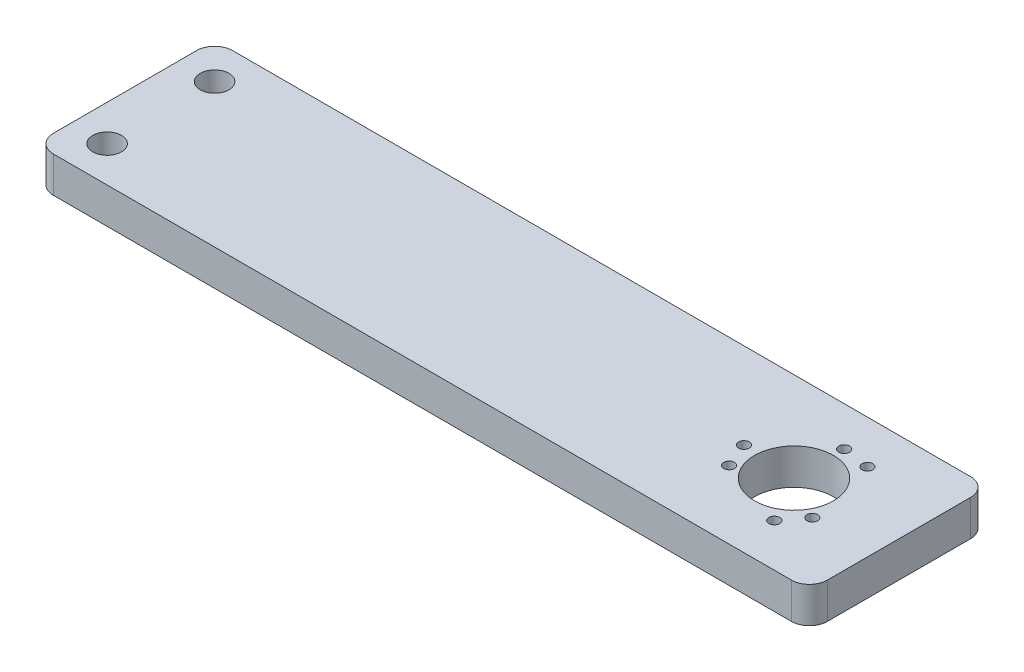
from build123d import *

# Parameters (mm, degrees)
SKETCH1_R           = 4
SKETCH1_R_2         = 11
SKETCH1_R_3         = 1.5
BOSS_EXTRUDE1_DEPTH = 10


with BuildPart() as part:
    # Sketch1 → Boss-Extrude1 (new body)
    with BuildSketch(Plane(origin=(0, 0, 0), x_dir=(1, 0, 0), z_dir=(0, 1, 0))):
        with BuildLine():
            Line((-103, -25), (103, -25))
            ThreePointArc((103, -25), (106.535533906, -23.535533906), (108, -20))
            Line((108, -20), (108, 20))
            ThreePointArc((108, 20), (106.535533906, 23.535533906), (103, 25))
            Line((103, 25), (-103, 25))
            ThreePointArc((-103, 25), (-106.535533906, 23.535533906), (-108, 20))
            Line((-108, 20), (-108, -20))
            ThreePointArc((-108, -20), (-106.535533906, -23.535533906), (-103, -25))
        make_face()
        with Locations(Location((-98, 15, 0), (0, 0, 270))):
            Circle(SKETCH1_R, mode=Mode.SUBTRACT)
        with Locations(Location((-98, -15, 0), (0, 0, 270))):
            Circle(SKETCH1_R, mode=Mode.SUBTRACT)
        with Locations(Location((78.7, 0, 0), (0, 0, 270))):
            Circle(SKETCH1_R_2, mode=Mode.SUBTRACT)
        with Locations(Location((78.7, 14, 0), (0, 0, 270))):
            Circle(SKETCH1_R_3, mode=Mode.SUBTRACT)
        with Locations(Location((86.2, 12.99038106, 0), (0, 0, 270))):
            Circle(SKETCH1_R_3, mode=Mode.SUBTRACT)
        with Locations(Location((90.82435565, -7.000000002, 0), (0, 0, 270))):
            Circle(SKETCH1_R_3, mode=Mode.SUBTRACT)
        with Locations(Location((86.199999997, -12.990381058, 0), (0, 0, 270))):
            Circle(SKETCH1_R_3, mode=Mode.SUBTRACT)
        with Locations(Location((63.7, 1.008931637, 0), (0, 0, 270))):
            Circle(SKETCH1_R_3, mode=Mode.SUBTRACT)
        with Locations(Location((66.57564435, -5.991068363, 0), (0, 0, 270))):
            Circle(SKETCH1_R_3, mode=Mode.SUBTRACT)
    extrude(amount=BOSS_EXTRUDE1_DEPTH)


solid = part.part
